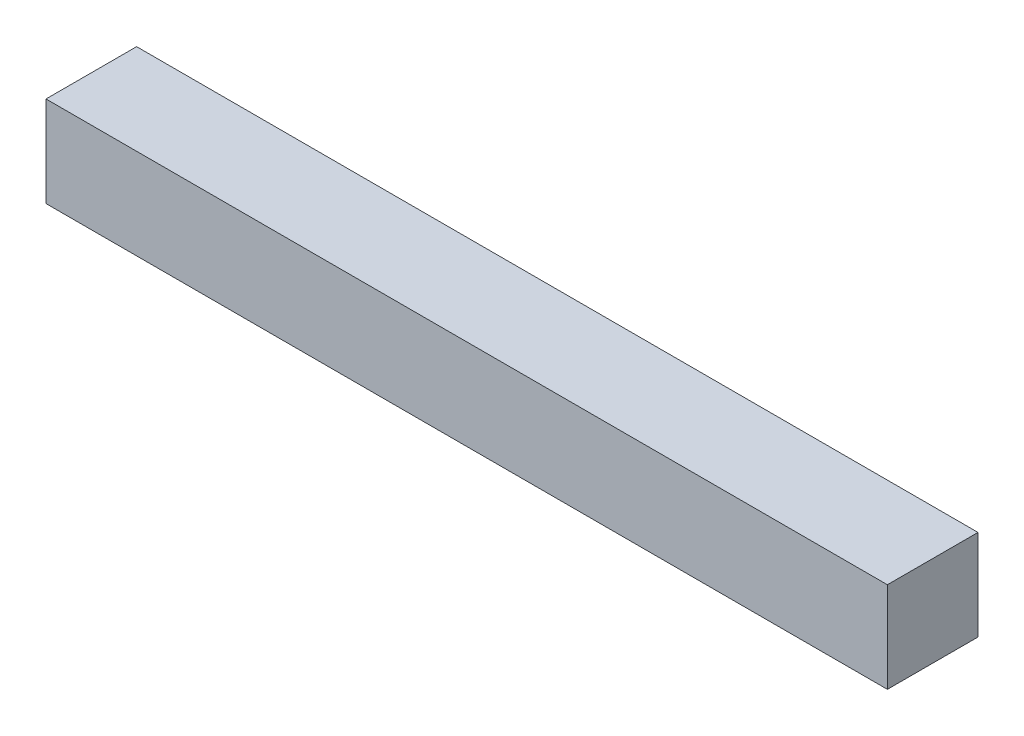
from build123d import *

# Parameters (mm, degrees)
SKETCH_1_W      = 260
SKETCH_1_H      = 28
EXTRUDE_1_DEPTH = 28


with BuildPart() as part:
    # 草图1 → 凸台-拉伸1 (new body)
    with BuildSketch(Plane.XY):
        Rectangle(SKETCH_1_W, SKETCH_1_H)
    extrude(amount=EXTRUDE_1_DEPTH)


solid = part.part
